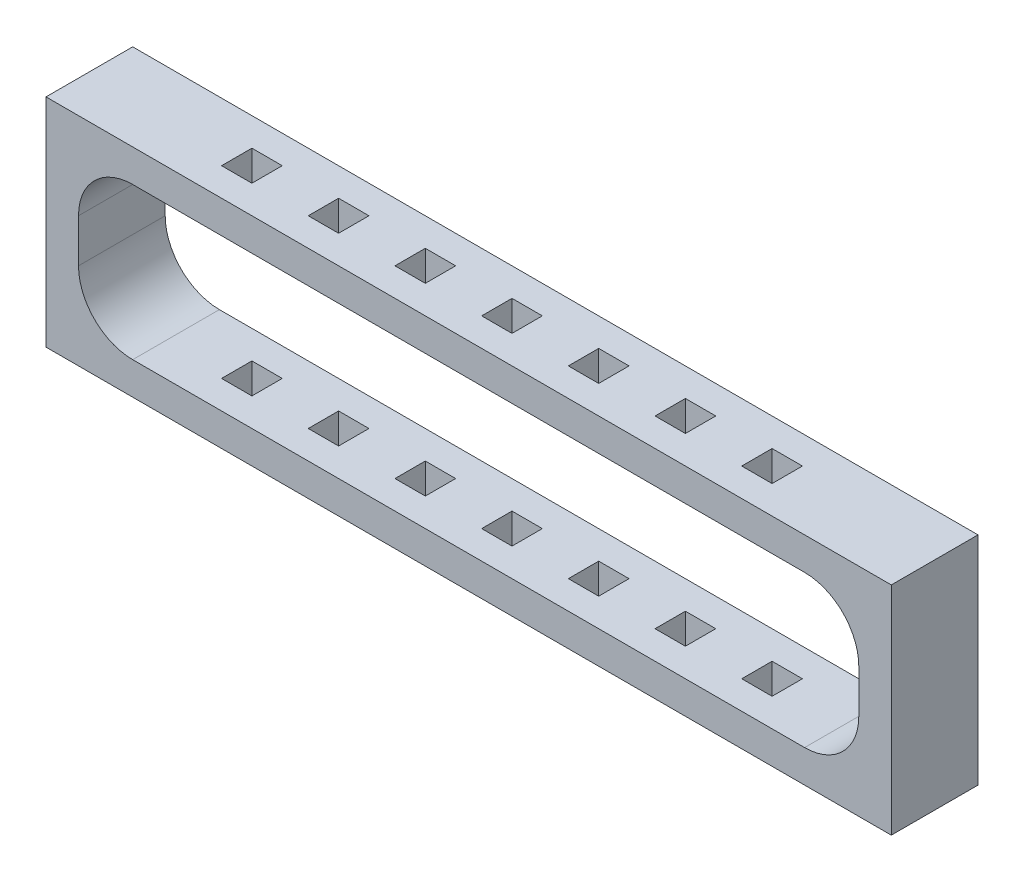
from build123d import *

# Parameters (mm, degrees)
ESBO_O1_W                = 78
ESBO_O1_H                = 20
RESSALTO_EXTRUS_O1_DEPTH = 8
ESBO_O2_W                = 2.8
ESBO_O2_H                = 2.8
CORTE_EXTRUS_O1_DEPTH    = 45.55333882


with BuildPart() as part:
    # Esboço1 → Ressalto-extrusão1 (new body)
    with BuildSketch(Plane.XY):
        Rectangle(ESBO_O1_W, ESBO_O1_H)
        with BuildLine():
            Line((-31, 7), (31, 7))
            ThreePointArc((31, 7), (34.535533906, 5.535533906), (36, 2))
            Line((36, 2), (36, -2))
            ThreePointArc((36, -2), (34.535533906, -5.535533906), (31, -7))
            Line((31, -7), (-31, -7))
            ThreePointArc((-31, -7), (-34.535533906, -5.535533906), (-36, -2))
            Line((-36, -2), (-36, 2))
            ThreePointArc((-36, 2), (-34.535533906, 5.535533906), (-31, 7))
        make_face(mode=Mode.SUBTRACT)
    extrude(amount=RESSALTO_EXTRUS_O1_DEPTH)

    # Esboço2 → Corte-extrusão1 (cut, through all)
    with BuildSketch(Plane(origin=(0, 10, 0), x_dir=(1, 0, 0), z_dir=(0, 1, 0))):
        with Locations((-8, -4)):
            Rectangle(ESBO_O2_W, ESBO_O2_H)
        with Locations((0, -4)):
            Rectangle(ESBO_O2_W, ESBO_O2_H)
        with Locations((-16, -4)):
            Rectangle(ESBO_O2_W, ESBO_O2_H)
        with Locations((-24, -4)):
            Rectangle(ESBO_O2_W, ESBO_O2_H)
        with Locations((24, -4)):
            Rectangle(ESBO_O2_W, ESBO_O2_H)
        with Locations((16, -4)):
            Rectangle(ESBO_O2_W, ESBO_O2_H)
        with Locations((8, -4)):
            Rectangle(ESBO_O2_W, ESBO_O2_H)
    extrude(amount=-CORTE_EXTRUS_O1_DEPTH, mode=Mode.SUBTRACT)


solid = part.part
